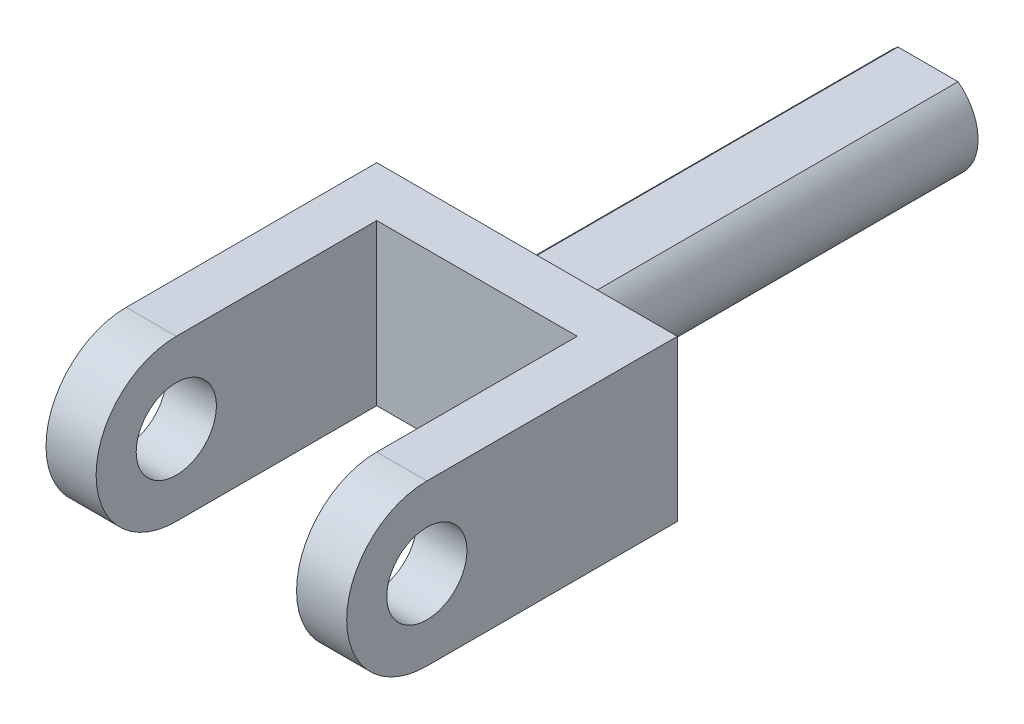
from build123d import *

# Parameters (mm, degrees)
SKETCH_2_R               = 4
EXTRUDE_1_DEPTH          = 15
CUT_EXTRUDE_1_DEPTH      = 38.121422387
CUT_EXTRUDE_1_DEPTH_BACK = 38.121422387
SKETCH_3_W               = 20
SKETCH_3_H               = 28
EXTRUDE_2_DEPTH          = 40


with BuildPart() as part:
    # 草图2 → 凸台-拉伸1 (new, symmetric)
    with BuildSketch(Plane(origin=(0, 0, 0), x_dir=(0, 0, -1), z_dir=(1, 0, 0))):
        with BuildLine():
            Line((-25, -8), (0, -8))
            Line((0, -8), (0, 8))
            Line((0, 8), (-25, 8))
            ThreePointArc((-25, 8), (-33, 0), (-25, -8))
        make_face()
        with Locations((-25, 0)):
            Circle(SKETCH_2_R, mode=Mode.SUBTRACT)
    extrude(amount=EXTRUDE_1_DEPTH, both=True)

    # 草图3 → 切除-拉伸1 (cut, two sides: drawn at the far end of the back side and taken through both)
    with BuildSketch(Plane(origin=(0, 0, 0), x_dir=(1, 0, 0), z_dir=(0, 1, 0)).offset(-CUT_EXTRUDE_1_DEPTH_BACK)):
        with Locations((0, -19)):
            Rectangle(SKETCH_3_W, SKETCH_3_H)
    extrude(amount=CUT_EXTRUDE_1_DEPTH + CUT_EXTRUDE_1_DEPTH_BACK, mode=Mode.SUBTRACT)

    # 草图4 → 凸台-拉伸2 (add)
    with BuildSketch(Plane(origin=(0, 0, 0), x_dir=(-1, 0, 0), z_dir=(0, 0, -1))):
        with BuildLine():
            Line((-3, -4), (3, -4))
            ThreePointArc((3, -4), (5, 0), (3, 4))
            Line((3, 4), (-3, 4))
            ThreePointArc((-3, 4), (-5, 0), (-3, -4))
        make_face()
    extrude(amount=EXTRUDE_2_DEPTH)


solid = part.part
